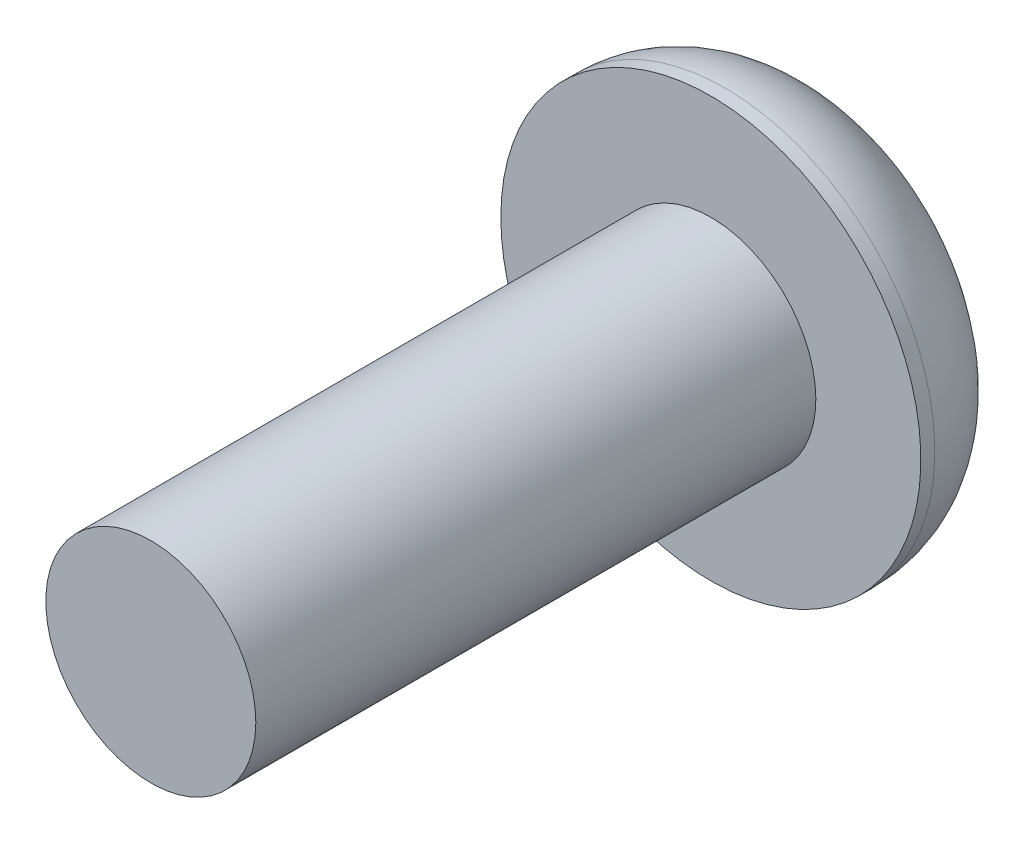
from build123d import *

# Parameters (mm, degrees)
SKETCH_1_R      = 1.5
EXTRUDE_1_DEPTH = 8
SKETCH_2_R      = 3
EXTRUDE_2_DEPTH = 1.7
FILLET_1_R      = 1.5


with BuildPart() as part:
    # Sketch 1 → 凸台-拉伸1 (new body)
    with BuildSketch(Plane.XY):
        Circle(SKETCH_1_R)
    extrude(amount=EXTRUDE_1_DEPTH)

    # 草图2 → 凸台-拉伸2 (add)
    with BuildSketch(Plane(origin=(0, 0, 0), x_dir=(-1, 0, 0), z_dir=(0, 0, -1))):
        Circle(SKETCH_2_R)
    extrude(amount=EXTRUDE_2_DEPTH)

    # 圆角1
    fillet_1_edges = [part.edges().sort_by_distance(p)[0] for p in [
        (3, 0, -1.7),
    ]]
    fillet(fillet_1_edges, radius=FILLET_1_R)


solid = part.part
